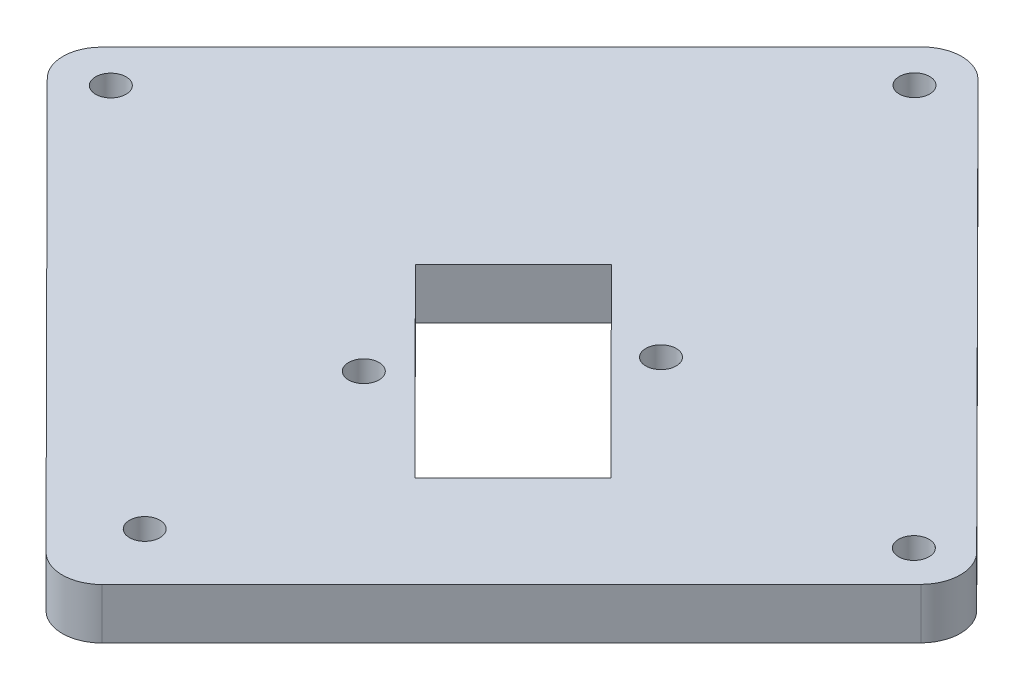
from build123d import *

# Parameters (mm, degrees)
SKETCH1_R           = 0.9525
BOSS_EXTRUDE1_DEPTH = 3.175


with BuildPart() as part:
    # Sketch1 → Boss-Extrude1 (new body)
    with BuildSketch(Plane(origin=(0, 0, 0), x_dir=(1, 0, 0), z_dir=(0, 1, 0))):
        with BuildLine():
            Line((0.836079848, 29.914691197), (-24.916908158, 4.139124102))
            ThreePointArc((-24.916908158, 4.139124102), (-25.559946724, 2.427169764), (-24.804168658, 0.761911295))
            Line((-24.804168658, 0.761911295), (0.802012418, -24.922477694))
            ThreePointArc((0.802012418, -24.922477694), (2.548586816, -25.648126247), (4.296057395, -24.924638497))
            Line((4.296057395, -24.924638497), (29.933843676, 0.727916893))
            ThreePointArc((29.933843676, 0.727916893), (30.658077132, 2.414753754), (30.022424716, 4.136926421))
            Line((30.022424716, 4.136926421), (4.329842419, 29.912525833))
            ThreePointArc((4.329842419, 29.912525833), (2.583410169, 30.638116576), (0.836079848, 29.914691197))
        make_face()
        with Locations(Location((2.67042066, 27.595082687, 0), (0, 0, 270))):
            Circle(SKETCH1_R, mode=Mode.SUBTRACT)
        with Locations(Location((-22.478149371, 2.417496952, 0), (0, 0, 270))):
            Circle(SKETCH1_R, mode=Mode.SUBTRACT)
        with Locations(Location((0.935185954, -5.154528514, 0), (0, 0, 270))):
            Circle(SKETCH1_R, mode=Mode.SUBTRACT)
        with Locations(Location((9.48030204, 4.90951313, 0), (0, 0, 270))):
            Circle(SKETCH1_R, mode=Mode.SUBTRACT)
        with Locations(Location((2.63009313, -20.568546616, 0), (0, 0, 270))):
            Circle(SKETCH1_R, mode=Mode.SUBTRACT)
        with Locations(Location((27.74686367, 2.479102218, 0), (0, 0, 270))):
            Circle(SKETCH1_R, mode=Mode.SUBTRACT)
        Polygon((8.316988679, -9.340962636), (-3.236630252, 2.247942235), (2.899230919, 8.38767289), (14.452988692, -3.201371075), align=None, mode=Mode.SUBTRACT)
    extrude(amount=BOSS_EXTRUDE1_DEPTH)


solid = part.part
